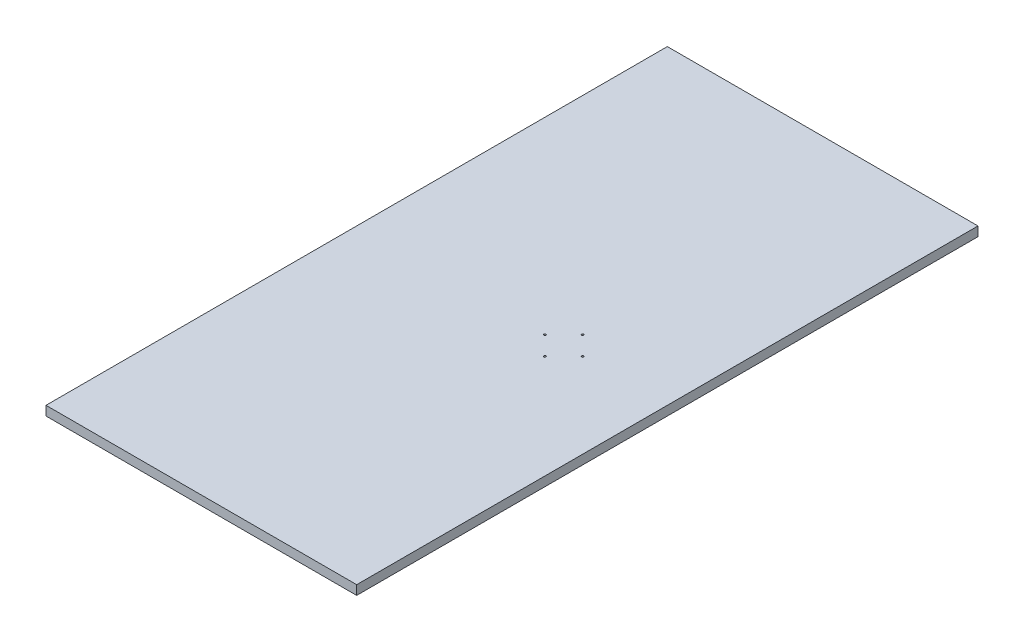
from build123d import *

# Parameters (mm, degrees)
SKETCH1_W           = 600
SKETCH1_H           = 1200
BOSS_EXTRUDE1_DEPTH = 18
SKETCH3_R           = 2
CUT_EXTRUDE1_DEPTH  = 672.061845138


with BuildPart() as part:
    # Sketch1 → Boss-Extrude1 (new body)
    with BuildSketch(Plane(origin=(0, 0, 0), x_dir=(1, 0, 0), z_dir=(0, 1, 0))):
        Rectangle(SKETCH1_W, SKETCH1_H)
    extrude(amount=BOSS_EXTRUDE1_DEPTH)

    # Sketch3 → Cut-Extrude1 (cut, through all)
    with BuildSketch(Plane(origin=(0, 18, 0), x_dir=(1, 0, 0), z_dir=(0, 1, 0))):
        with Locations(Location((100, 36.5, 0), (0, 0, 270))):
            Circle(SKETCH3_R)
        with Locations(Location((100, -36.5, 0), (0, 0, 270))):
            Circle(SKETCH3_R)
        with Locations(Location((136.5, 0, 0), (0, 0, 270))):
            Circle(SKETCH3_R)
        with Locations(Location((63.5, 0, 0), (0, 0, 270))):
            Circle(SKETCH3_R)
    extrude(amount=-CUT_EXTRUDE1_DEPTH, mode=Mode.SUBTRACT)


solid = part.part
